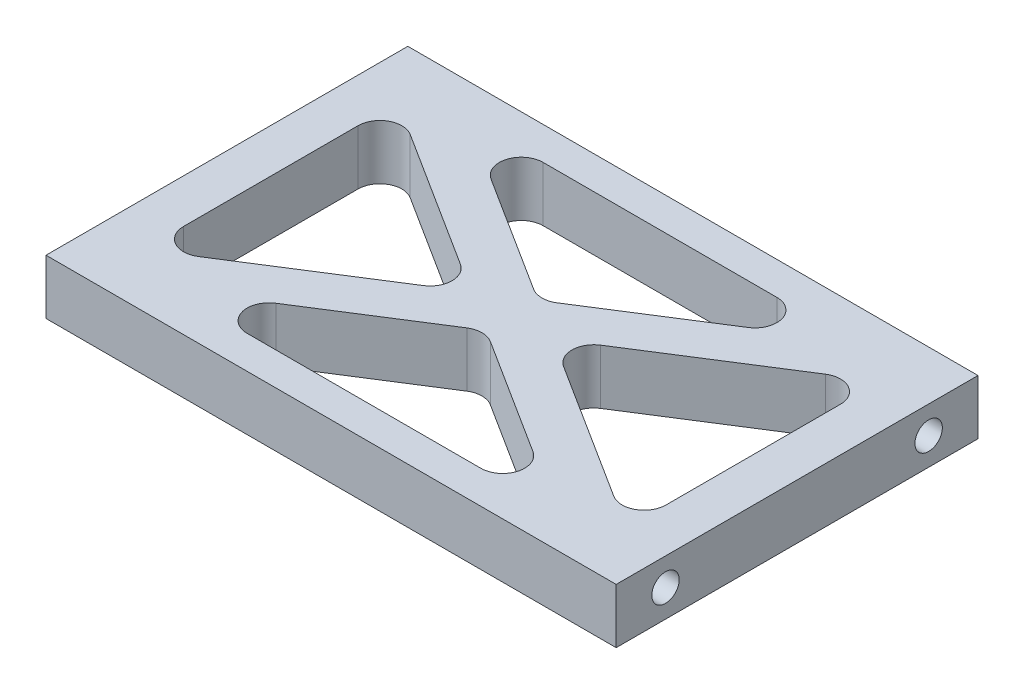
from build123d import *

# Parameters (mm, degrees)
SKETCH1_W           = 52
SKETCH1_H           = 33
BOSS_EXTRUDE1_DEPTH = 5
FILLET1_R           = 2
SKETCH2_R           = 1.25
CUT_EXTRUDE1_DEPTH  = 12


with BuildPart() as part:
    # Sketch1 → Boss-Extrude1 (new body)
    with BuildSketch(Plane(origin=(0, 0, 0), x_dir=(1, 0, 0), z_dir=(0, 1, 0))):
        with Locations((26, 16.5)):
            Rectangle(SKETCH1_W, SKETCH1_H)
        Polygon((4, 28.092794755), (4, 4.907205245), (22.26743416, 16.5), align=None, mode=Mode.SUBTRACT)
        Polygon((26, 14.131256294), (8.459838567, 3), (43.540161433, 3), align=None, mode=Mode.SUBTRACT)
        Polygon((48, 4.907205245), (29.73256584, 16.5), (48, 28.092794755), align=None, mode=Mode.SUBTRACT)
        Polygon((8.459838567, 30), (43.540161433, 30), (26, 18.868743706), align=None, mode=Mode.SUBTRACT)
    extrude(amount=BOSS_EXTRUDE1_DEPTH)

    # Fillet1
    fillet1_edges = [part.edges().sort_by_distance(p)[0] for p in [
        (22.26743416, 2.5, -16.5),
        (4, 2.5, -28.092794755),
        (4, 2.5, -4.907205245),
        (43.540161433, 2.5, -3),
        (26, 2.5, -14.131256294),
        (8.459838567, 2.5, -3),
        (48, 2.5, -4.907205245),
        (48, 2.5, -28.092794755),
        (29.73256584, 2.5, -16.5),
        (8.459838567, 2.5, -30),
        (26, 2.5, -18.868743706),
        (43.540161433, 2.5, -30),
    ]]
    fillet(fillet1_edges, radius=FILLET1_R)

    # Sketch2 → Cut-Extrude1 (cut)
    with BuildSketch(Plane(origin=(52, 0, 0), x_dir=(0, 0, -1), z_dir=(1, 0, 0))):
        with Locations((4.5, 2.5)):
            Circle(SKETCH2_R)
        with Locations(Location((28.5, 2.5, 0), (0, 0, 180))):
            Circle(SKETCH2_R)
    cut_extrude1 = extrude(amount=-CUT_EXTRUDE1_DEPTH, mode=Mode.SUBTRACT)

    # Mirror1: Cut-Extrude1 across plane
    add(cut_extrude1.mirror(Plane(origin=(26, 0, 0), x_dir=(0, 0, 1), z_dir=(1, 0, 0))), mode=Mode.SUBTRACT)


solid = part.part
